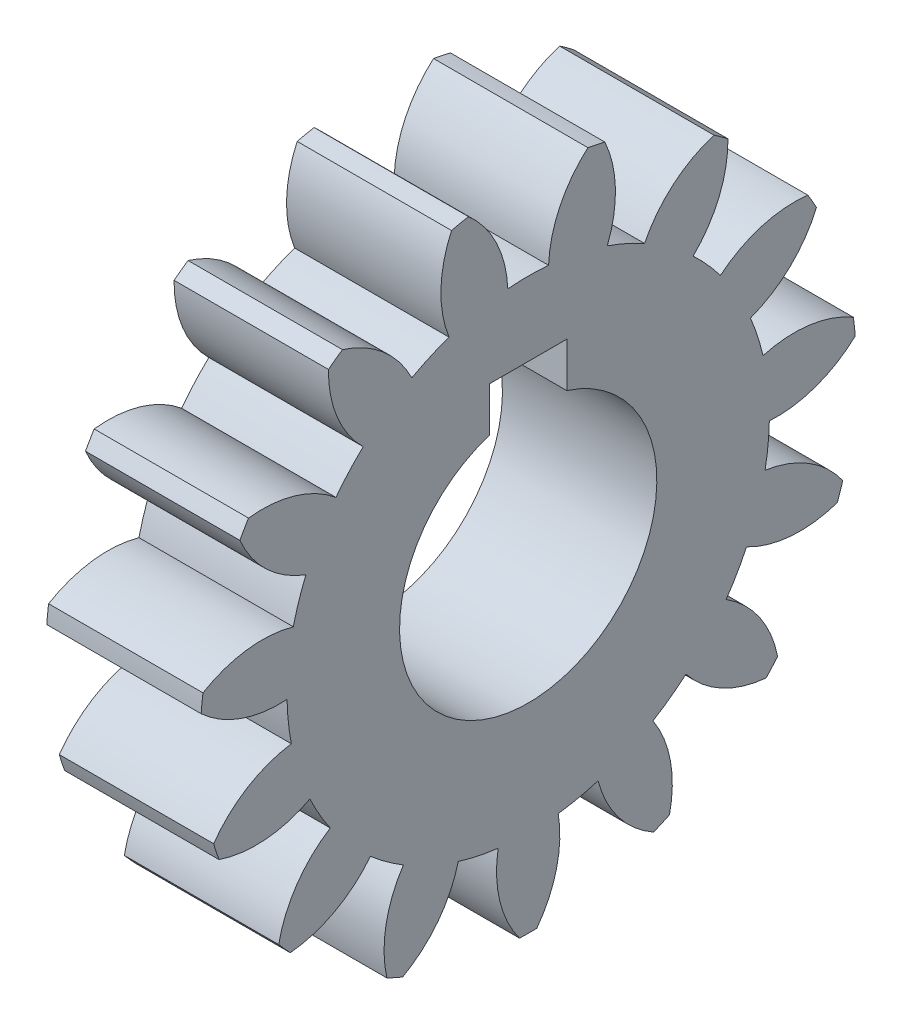
from build123d import *

# Parameters (mm, degrees)
BASPROSKE_W             = 12
BASPROSKE_H             = 25.5
TOOTHCUT_DEPTH          = 39.006578378
TEETHCUTS_COUNT         = 15
TEETHCUTS_ANGLE         = 336
BORSKE_R                = 10
BORE_DEPTH              = 50.0000508
CUT_EXTRUDE1_DEPTH      = 38.954121274
CUT_EXTRUDE1_DEPTH_BACK = 38.954121274
SKETCH1_W               = 6
SKETCH1_H               = 6


with BuildPart() as part:
    # BasProSke → Base-Revolve (revolve)
    with BuildSketch(Plane(origin=(0, 0, 0), x_dir=(1, 0, 0), z_dir=(0, 1, 0)), mode=Mode.PRIVATE) as base_revolve_sk:
        with Locations((6, 12.75)):
            Rectangle(BASPROSKE_W, BASPROSKE_H)
    revolve(base_revolve_sk.sketch.rotate(Axis((-10, 0, 0), (1, 0, 0)), 180), axis=Axis((-10, 0, 0), (1, 0, 0)))

    # TooCutSke → ToothCut (cut, through all)
    with BuildSketch(Plane(origin=(0, 0, 0), x_dir=(0, 0, -1), z_dir=(1, 0, 0))):
        with BuildLine():
            ThreePointArc((1.584594428, 18.681918036), (0, 18.749), (-1.584594428, 18.681918036))
            ThreePointArc((-1.584594428, 18.681918036), (-2.465052499, 22.206073835), (-4.666912141, 25.095138498))
            ThreePointArc((-4.666912141, 25.095138498), (0, 25.5254), (4.666912141, 25.095138498))
            ThreePointArc((4.666912141, 25.095138498), (2.465052499, 22.206073835), (1.584594428, 18.681918036))
        make_face()
    toothcut = extrude(amount=TOOTHCUT_DEPTH, mode=Mode.SUBTRACT)

    # TeethCuts: ToothCut ×15 about axis
    teethcuts_axis = Axis((-10, 0, 0), (1, 0, 0))
    for i in range(1, TEETHCUTS_COUNT):
        add(toothcut.rotate(teethcuts_axis, i * TEETHCUTS_ANGLE / (TEETHCUTS_COUNT - 1)), mode=Mode.SUBTRACT)

    # BorSke → Bore (cut, symmetric)
    with BuildSketch(Plane(origin=(0, 0, 0), x_dir=(0, 0, -1), z_dir=(1, 0, 0))):
        with Locations(Location((0, 0, 0), (0, 0, 180))):
            Circle(BORSKE_R)
    extrude(amount=BORE_DEPTH, both=True, mode=Mode.SUBTRACT)

    # Sketch1 → Cut-Extrude1 (cut, two sides: drawn at the far end of the back side and taken through both)
    with BuildSketch(Plane(origin=(0, 0, 0), x_dir=(0, 0, -1), z_dir=(1, 0, 0)).offset(-CUT_EXTRUDE1_DEPTH_BACK)):
        with Locations((0, 10)):
            Rectangle(SKETCH1_W, SKETCH1_H)
    extrude(amount=CUT_EXTRUDE1_DEPTH + CUT_EXTRUDE1_DEPTH_BACK, mode=Mode.SUBTRACT)


solid = part.part
